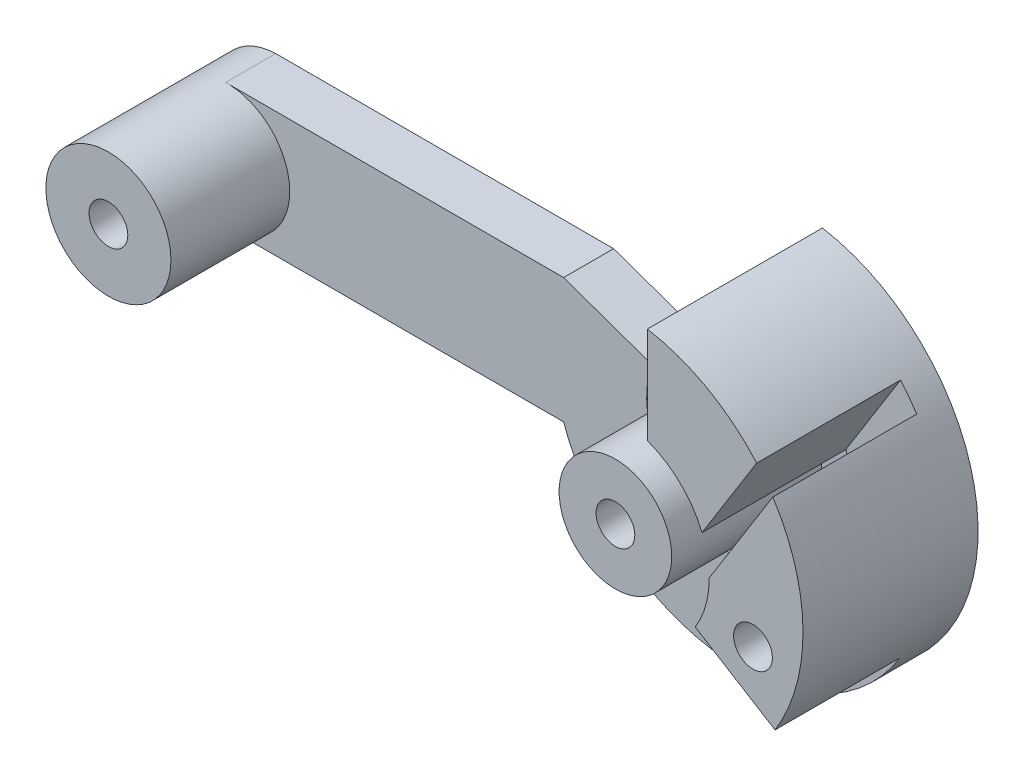
from build123d import *
from build123d.topology import SkipClean

# Parameters (mm, degrees)
BOSS_EXTRU_1_DEPTH      = 7
BOSS_EXTRU_1_DEPTH_BACK = 7
ESQUISSE1_R             = 1.55
ESQUISSE3_R             = 7.5
ESQUISSE3_R_2           = 4.5
ENL_V_MAT_EXTRU_1_DEPTH = 12
ENL_V_MAT_EXTRU_2_REACH = 61.679
ESQUISSE5_R             = 1.55
ENL_V_MAT_EXTRU_3_DEPTH = 14
ENL_V_MAT_EXTRU_4_DEPTH = 11.5
ENL_V_MAT_EXTRU_5_DEPTH = 10
ESQUISSE8_R             = 5
ESQUISSE8_R_2           = 1.55
BOSS_EXTRU_3_DEPTH      = 9.5
SKETCH1_R               = 1.55
CUT_EXTRUDE1_DEPTH      = 14


with BuildPart() as part:
    # Esquisse1 → Boss.-Extru.1 (new, two sides: drawn at the far end of the back side and taken through both)
    with BuildSketch(Plane.XY.offset(-BOSS_EXTRU_1_DEPTH_BACK)):
        with BuildLine():
            Line((-0.121307676, 4.998528228), (26.897812493, 4.998528228))
            ThreePointArc((26.897812493, 4.998528228), (43.36686221, 14.818498296), (56.034466428, 0.42429064))
            ThreePointArc((56.034466428, 0.42429064), (43.785088024, -14.746764493), (26.897812493, -4.998528228))
            Line((26.897812493, -4.998528228), (-0.121307676, -4.998528228))
            ThreePointArc((-0.121307676, -4.998528228), (-5, 0), (-0.121307676, 4.998528228))
        make_face()
        Circle(ESQUISSE1_R, mode=Mode.SUBTRACT)
    extrude(amount=BOSS_EXTRU_1_DEPTH + BOSS_EXTRU_1_DEPTH_BACK)

    # Esquisse3 → Enlèv. mat.-Extru.1 (cut)
    with BuildSketch(Plane.XY.offset(7)):
        with Locations((41.040468381, 0)):
            Circle(ESQUISSE3_R)
        with Locations((41.040468381, 0)):
            Circle(ESQUISSE3_R_2, mode=Mode.SUBTRACT)
    extrude(amount=-ENL_V_MAT_EXTRU_1_DEPTH, mode=Mode.SUBTRACT)

    # Enlèv. mat.-Extru.2: up to this face of the body (flat: up to its plane)
    enl_v_mat_extru_2_end = Plane(part.part.faces().sort_by_distance((32.334245268, 0, -7))[0])
    # Esquisse4 → Enlèv. mat.-Extru.2 (cut, up to the picked face)
    with BuildSketch(Plane.XY.offset(7), mode=Mode.PRIVATE) as enl_v_mat_extru_2_sk1:
        with BuildLine():
            Line((26.897812493, 4.998528228), (33.969140437, 2.499264114))
            ThreePointArc((33.969140437, 2.499264114), (37.833778623, 6.779907138), (43.594458809, 7.051746797))
            Line((43.594458809, 7.051746797), (43.594458809, 14.780971987))
            ThreePointArc((43.594458809, 14.780971987), (33.45770218, 12.942243111), (26.897812493, 4.998528228))
        make_face()
    enl_v_mat_extru_2_tool1 = split(extrude(enl_v_mat_extru_2_sk1.sketch, amount=-ENL_V_MAT_EXTRU_2_REACH, mode=Mode.PRIVATE), bisect_by=enl_v_mat_extru_2_end, keep=Keep.BOTH, mode=Mode.PRIVATE)
    add(enl_v_mat_extru_2_tool1.solids().sort_by(Axis((35.915209, 9.281231, 7), (0, 0, -1)))[0], mode=Mode.SUBTRACT)

    # Esquisse5 → Enlèv. mat.-Extru.3 (cut)
    with BuildSketch(Plane.XY.offset(7)):
        with Locations((41.040468381, 0)):
            Circle(ESQUISSE5_R)
    extrude(amount=-ENL_V_MAT_EXTRU_3_DEPTH, mode=Mode.SUBTRACT)

    # Esquisse6 → Enlèv. mat.-Extru.4 (cut)
    with BuildSketch(Plane(origin=(0, 0, 7), x_dir=(-1, 0, 0), z_dir=(0, 0, -1))):
        with BuildLine():
            Line((-47.967646393, 2.874752996), (-52.337500651, 9.867981652))
            ThreePointArc((-52.337500651, 9.867981652), (-53.013141031, 9.036321686), (-53.627686287, 8.158550445))
            Line((-53.627686287, 8.158550445), (-48.540448501, 0.017268159))
            ThreePointArc((-48.540448501, 0.017268159), (-48.394176822, 1.474100456), (-47.967646393, 2.874752996))
        make_face()
    extrude(amount=ENL_V_MAT_EXTRU_4_DEPTH, mode=Mode.SUBTRACT)

    # Esquisse7 → Enlèv. mat.-Extru.5 (cut)
    with BuildSketch(Plane.XY.offset(7)):
        with BuildLine():
            Line((47.423042191, -3.938623052), (53.805616002, -7.877246105))
            ThreePointArc((53.805616002, -7.877246105), (39.444806634, -14.914887314), (26.897812493, -4.998528228))
            Line((26.897812493, -4.998528228), (-0.121307676, -4.998528228))
            ThreePointArc((-0.121307676, -4.998528228), (-5.242615351, 0), (-0.121307676, 4.998528228))
            Line((-0.121307676, 4.998528228), (26.897812493, 4.998528228))
            Line((26.897812493, 4.998528228), (33.969140437, 2.499264114))
            ThreePointArc((33.969140437, 2.499264114), (37.803155706, -6.76533862), (47.423042191, -3.938623052))
        make_face()
    extrude(amount=-ENL_V_MAT_EXTRU_5_DEPTH, mode=Mode.SUBTRACT)

    # Esquisse8 → Boss.-Extru.3 (add)
    with SkipClean():  # the faces are left unmerged after this step: merging them gives an invalid solid
        with BuildSketch(Plane.XY.offset(-3)):
            Circle(ESQUISSE8_R)
            Circle(ESQUISSE8_R_2, mode=Mode.SUBTRACT)
        extrude(amount=BOSS_EXTRU_3_DEPTH)

    # Sketch1 → Cut-Extrude1 (cut)
    with SkipClean():  # the faces are left unmerged after this step: merging them gives an invalid solid
        with BuildSketch(Plane.XY.offset(7)):
            with Locations((52.040468381, -3)):
                Circle(SKETCH1_R)
        extrude(amount=-CUT_EXTRUDE1_DEPTH, mode=Mode.SUBTRACT)


solid = part.part
